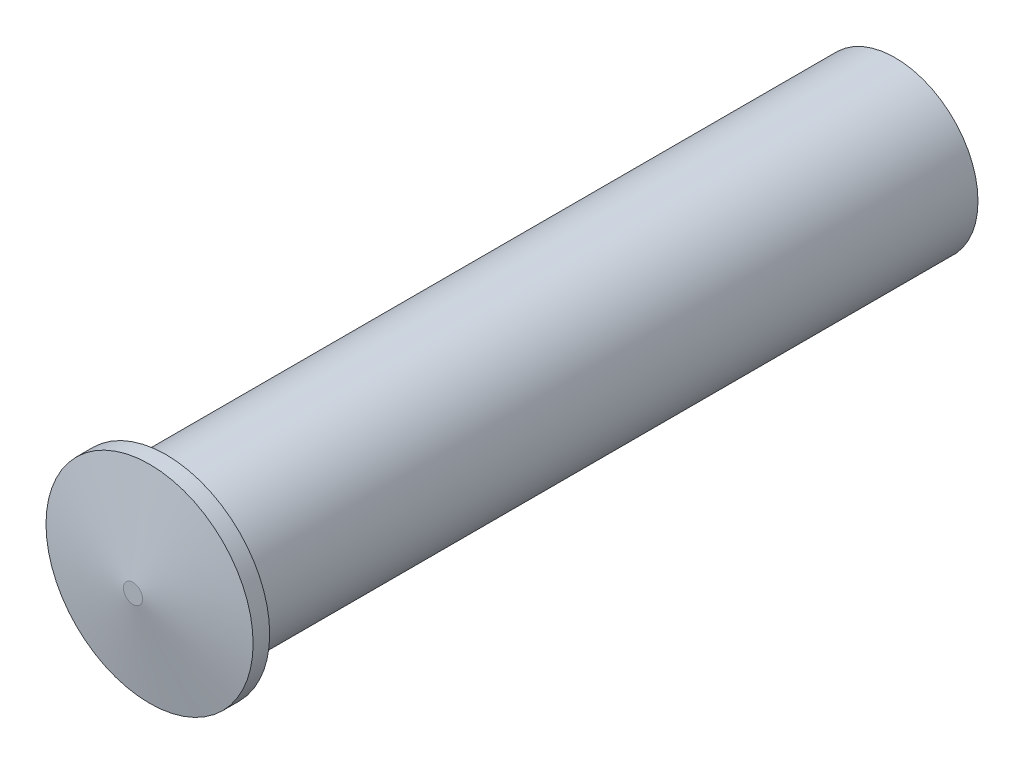
from build123d import *

# Parameters (mm, degrees)
SKETCH1_R           = 10
BOSS_EXTRUDE2_DEPTH = 88
SKETCH5_R           = 12.5
BOSS_EXTRUDE3_DEPTH = 2
SKETCH6_R           = 12.5
BOSS_EXTRUDE4_DEPTH = 2
BOSS_EXTRUDE4_TAPER = 80
SKETCH7_R           = 8
CUT_EXTRUDE1_DEPTH  = 88


with BuildPart() as part:
    # Sketch1 → Boss-Extrude2 (new body)
    with BuildSketch(Plane.XY):
        Circle(SKETCH1_R)
    extrude(amount=-BOSS_EXTRUDE2_DEPTH)

    # Sketch5 → Boss-Extrude3 (add)
    with BuildSketch(Plane.XY):
        Circle(SKETCH5_R)
    extrude(amount=BOSS_EXTRUDE3_DEPTH)

    # Sketch6 → Boss-Extrude4 (add)
    with BuildSketch(Plane.XY.offset(2)):
        Circle(SKETCH6_R)
    extrude(amount=BOSS_EXTRUDE4_DEPTH, taper=BOSS_EXTRUDE4_TAPER)

    # Sketch7 → Cut-Extrude1 (cut)
    with BuildSketch(Plane(origin=(0, 0, -88), x_dir=(-1, 0, 0), z_dir=(0, 0, -1))):
        Circle(SKETCH7_R)
    extrude(amount=-CUT_EXTRUDE1_DEPTH, mode=Mode.SUBTRACT)


solid = part.part
